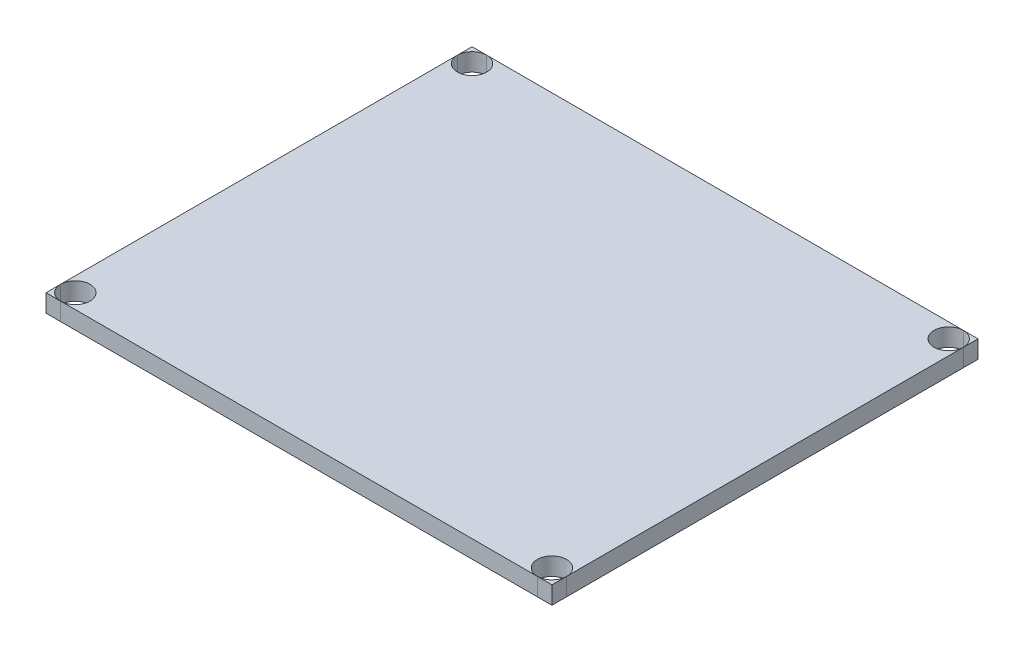
from build123d import *

# Parameters (mm, degrees)
BOSS_EXTRUDE1_DEPTH = 2


with BuildPart() as part:
    # Sketch1 → Boss-Extrude1 (new body)
    with BuildSketch(Plane(origin=(0, 0, 0), x_dir=(1, 0, 0), z_dir=(0, 1, 0))):
        with BuildLine():
            Line((-26.85, 24), (-28.5, 24))
            Line((-28.5, 24), (-28.5, 22.35))
            ThreePointArc((-28.5, 22.35), (-28.016726189, 23.516726189), (-26.85, 24))
        make_face()
        with BuildLine():
            Line((26.85, 24), (-26.85, 24))
            ThreePointArc((-26.85, 24), (-25.683273811, 21.183273811), (-28.5, 22.35))
            Line((-28.5, 22.35), (-28.5, -22.349999993))
            ThreePointArc((-28.5, -22.349999993), (-25.683273809, -21.183273813), (-26.85, -24))
            Line((-26.85, -24), (26.85, -24))
            ThreePointArc((26.85, -24), (25.683273811, -21.183273811), (28.5, -22.35))
            Line((28.5, -22.35), (28.5, 22.35))
            ThreePointArc((28.5, 22.35), (25.683273811, 21.183273811), (26.85, 24))
        make_face()
        with BuildLine():
            Line((28.5, 24), (26.85, 24))
            ThreePointArc((26.85, 24), (28.016726189, 23.516726189), (28.5, 22.35))
            Line((28.5, 22.35), (28.5, 24))
        make_face()
        with BuildLine():
            ThreePointArc((-26.85, -24), (-28.016726191, -23.516726187), (-28.5, -22.349999993))
            Line((-28.5, -22.349999993), (-28.5, -24))
            Line((-28.5, -24), (-26.85, -24))
        make_face()
        with BuildLine():
            Line((28.5, -24), (28.5, -22.35))
            ThreePointArc((28.5, -22.35), (28.016726189, -23.516726189), (26.85, -24))
            Line((26.85, -24), (28.5, -24))
        make_face()
    extrude(amount=BOSS_EXTRUDE1_DEPTH)


solid = part.part
